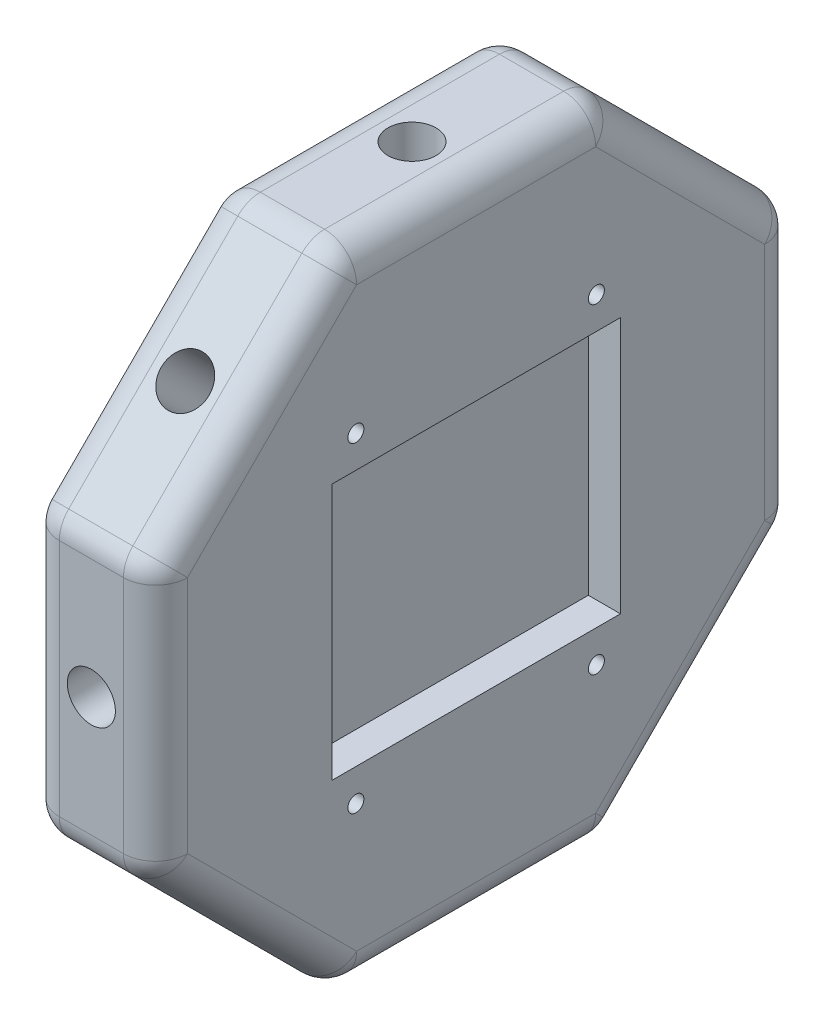
from build123d import *

# Parameters (mm, degrees)
BOSS_EXTRUDE2_DEPTH = 80
FILLET2_R           = 20
SKETCH5_R           = 15
CUT_EXTRUDE2_DEPTH  = 50
CIRPATTERN3_COUNT   = 8
SKETCH6_R           = 5
CUT_EXTRUDE3_DEPTH  = 294.938769134
SKETCH7_W           = 180
SKETCH7_H           = 160
CUT_EXTRUDE4_DEPTH  = 20
CHAMFER1_SIZE       = 10


with BuildPart() as part:
    # Sketch4 → Boss-Extrude2 (new body)
    with BuildSketch(Plane(origin=(0, 0, 0), x_dir=(0, 0, -1), z_dir=(1, 0, 0))):
        Polygon((82.842712475, 200), (-82.842712475, 200), (-200, 82.842712475), (-200, -82.842712475), (-82.842712475, -200), (82.842712475, -200), (200, -82.842712475), (200, 82.842712475), align=None)
    extrude(amount=BOSS_EXTRUDE2_DEPTH)

    # Fillet2
    fillet2_edges = [part.edges().sort_by_distance(p)[0] for p in [
        (80, 141.421356237, 141.421356237),
        (0, 200, 0),
        (0, 141.421356237, -141.421356237),
        (80, 0, 200),
        (40, 82.842712475, -200),
        (40, -82.842712475, -200),
        (40, -200, -82.842712475),
        (40, -200, 82.842712475),
        (40, -82.842712475, 200),
        (40, 82.842712475, 200),
        (40, 200, 82.842712475),
        (40, 200, -82.842712475),
        (80, -141.421356237, 141.421356237),
        (80, -200, 0),
        (80, -141.421356237, -141.421356237),
        (80, 0, -200),
        (80, 141.421356237, -141.421356237),
        (80, 200, 0),
        (0, 0, -200),
        (0, -141.421356237, -141.421356237),
        (0, -200, 0),
        (0, -141.421356237, 141.421356237),
        (0, 0, 200),
        (0, 141.421356237, 141.421356237),
    ]]
    fillet(fillet2_edges, radius=FILLET2_R)

    # Sketch5 → Cut-Extrude2 (cut)
    with BuildSketch(Plane(origin=(0, -141.421356237, -141.421356237), x_dir=(1, 0, 0), z_dir=(0, -0.7071067811865474, -0.7071067811865477))):
        with Locations(Location((40, 0, 0), (0, 0, 270))):
            Circle(SKETCH5_R)
    cut_extrude2 = extrude(amount=-CUT_EXTRUDE2_DEPTH, mode=Mode.SUBTRACT)

    # CirPattern3: Cut-Extrude2 ×8 about axis
    cirpattern3_axis = Axis((0, 0, 0), (1, 0, 0))
    for i in range(1, CIRPATTERN3_COUNT):
        add(cut_extrude2.rotate(cirpattern3_axis, i * 360 / CIRPATTERN3_COUNT), mode=Mode.SUBTRACT)

    # Sketch6 → Cut-Extrude3 (cut, through all)
    with BuildSketch(Plane.ZY):
        with Locations((75, 100)):
            Circle(SKETCH6_R)
        with Locations(Location((-75, 100, 0), (0, 0, 180))):
            Circle(SKETCH6_R)
        with Locations((-75, -100)):
            Circle(SKETCH6_R)
        with Locations(Location((75, -100, 0), (0, 0, 180))):
            Circle(SKETCH6_R)
    extrude(amount=-CUT_EXTRUDE3_DEPTH, mode=Mode.SUBTRACT)

    # Sketch7 → Cut-Extrude4 (cut)
    with BuildSketch(Plane(origin=(80, 0, 0), x_dir=(0, 0, -1), z_dir=(1, 0, 0))):
        Rectangle(SKETCH7_W, SKETCH7_H)
    extrude(amount=-CUT_EXTRUDE4_DEPTH, mode=Mode.SUBTRACT)

    # Chamfer1
    chamfer1_edges = [part.edges().sort_by_distance(p)[0] for p in [
        (0, -100, 80),
        (0, -100, -80),
        (0, 100, -70),
        (0, 100, 70),
    ]]
    chamfer(chamfer1_edges, length=CHAMFER1_SIZE)


solid = part.part
